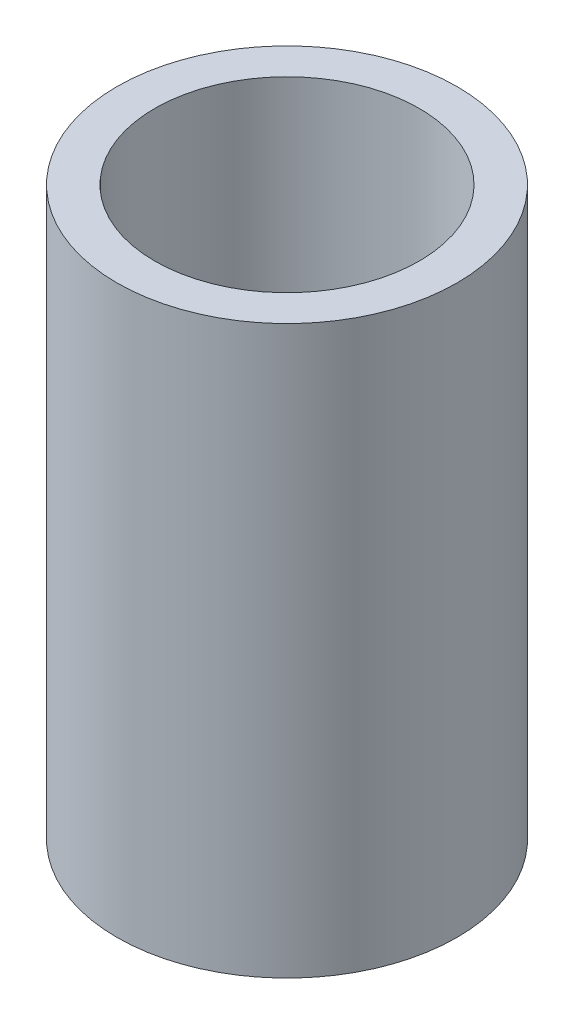
from build123d import *

# Parameters (mm, degrees)
SKETCH1_R           = 28.575
SKETCH1_R_2         = 22.225
BOSS_EXTRUDE1_DEPTH = 95.25


with BuildPart() as part:
    # Sketch1 → Boss-Extrude1 (new body)
    with BuildSketch(Plane(origin=(0, 0, 0), x_dir=(1, 0, 0), z_dir=(0, 1, 0))):
        with Locations(Location((0, 0, 0), (0, 0, 270))):
            Circle(SKETCH1_R)
        with Locations(Location((0, 0, 0), (0, 0, 270))):
            Circle(SKETCH1_R_2, mode=Mode.SUBTRACT)
    extrude(amount=BOSS_EXTRUDE1_DEPTH)


solid = part.part
